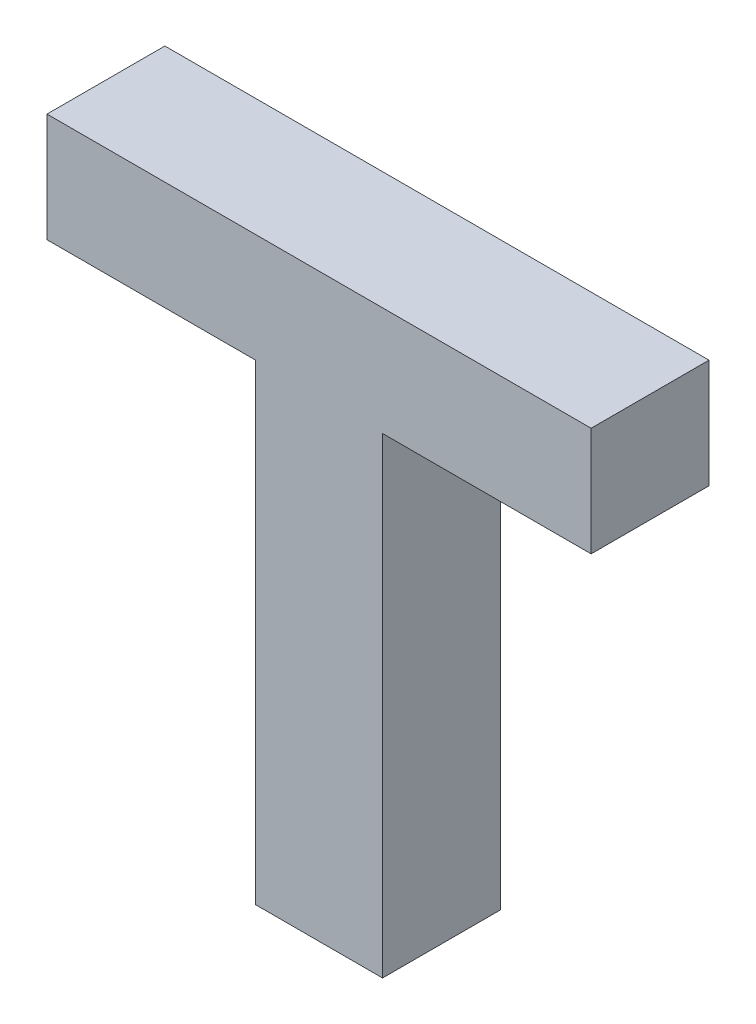
from build123d import *

# Parameters (mm, degrees)
SKETCH1_W           = 30
SKETCH1_H           = 32
BOSS_EXTRUDE1_DEPTH = 6.5
CUT_EXTRUDE1_REACH  = 46.342
SKETCH2_W           = 11.5
SKETCH2_H           = 26


with BuildPart() as part:
    # Sketch1 → Boss-Extrude1 (new body)
    with BuildSketch(Plane.XY):
        with Locations((15, 16)):
            Rectangle(SKETCH1_W, SKETCH1_H)
    extrude(amount=BOSS_EXTRUDE1_DEPTH)

    # Sketch2 → Cut-Extrude1 (cut, up to next)
    with BuildSketch(Plane.XY.offset(6.5), mode=Mode.PRIVATE) as cut_extrude1_sk1:
        with Locations((5.75, 13)):
            Rectangle(SKETCH2_W, SKETCH2_H)
    cut_extrude1_tool1 = extrude(cut_extrude1_sk1.sketch, amount=-CUT_EXTRUDE1_REACH, mode=Mode.PRIVATE) & part.part
    # Sketch2 → Cut-Extrude1 (cut, up to next)
    with BuildSketch(Plane.XY.offset(6.5), mode=Mode.PRIVATE) as cut_extrude1_sk2:
        with Locations((24.25, 13)):
            Rectangle(SKETCH2_W, SKETCH2_H)
    cut_extrude1_tool2 = extrude(cut_extrude1_sk2.sketch, amount=-CUT_EXTRUDE1_REACH, mode=Mode.PRIVATE) & part.part
    add(cut_extrude1_tool1.solids().sort_by_distance((5.75, 13, 6.5))[0], mode=Mode.SUBTRACT)
    add(cut_extrude1_tool2.solids().sort_by_distance((24.25, 13, 6.5))[0], mode=Mode.SUBTRACT)


solid = part.part
